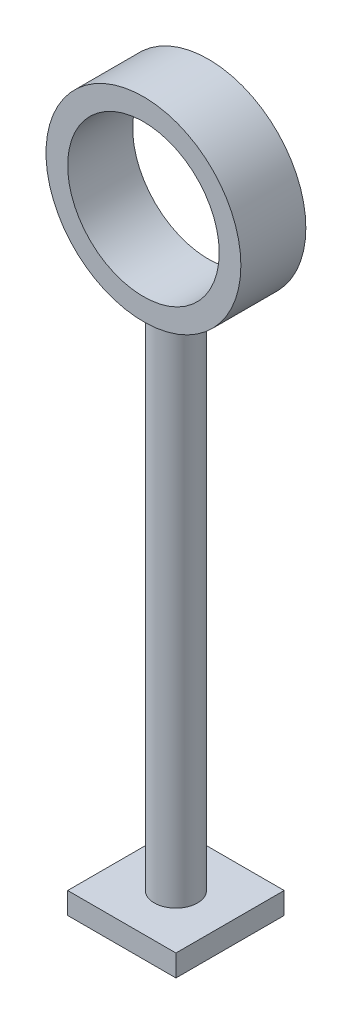
from build123d import *

# Parameters (mm, degrees)
SKETCH_1_R           = 22.5
SKETCH_1_R_2         = 17.5
EXTRUDE_1_DEPTH      = 15
EXTRUDE_2_REACH      = 166.735
EXTRUDE_2_END_RADIUS = 22.5
SKETCH_2_R           = 5
SKETCH_3_W           = 25
SKETCH_3_H           = 25
EXTRUDE_3_DEPTH      = 5


with BuildPart() as part:
    # 草图1 → 凸台-拉伸1 (new body)
    with BuildSketch(Plane.XY):
        Circle(SKETCH_1_R)
        Circle(SKETCH_1_R_2, mode=Mode.SUBTRACT)
    extrude(amount=EXTRUDE_1_DEPTH)

    # 凸台-拉伸2: up to this cylinder (the profile starts outside it)
    extrude_2_end = Plane(origin=(0, 0, 7.5), z_dir=(0, 0, -1)) * Cylinder(EXTRUDE_2_END_RADIUS, 379.47, mode=Mode.PRIVATE)
    # 草图2 → 凸台-拉伸2 (add, up to the surface)
    with BuildSketch(Plane(origin=(0, -140, 0), x_dir=(1, 0, 0), z_dir=(0, 1, 0)), mode=Mode.PRIVATE) as extrude_2_sk1:
        with Locations(Location((0, -7.5, 0), (0, 0, 90))):
            Circle(SKETCH_2_R)
    extrude_2_tool1 = extrude(extrude_2_sk1.sketch, amount=EXTRUDE_2_REACH, mode=Mode.PRIVATE) - extrude_2_end
    add(extrude_2_tool1.solids().sort_by_distance((0, -140, 7.5))[0])

    # 草图3 → 凸台-拉伸3 (add)
    with BuildSketch(Plane.XZ.offset(140)):
        with Locations((0, 7.5)):
            Rectangle(SKETCH_3_W, SKETCH_3_H)
    extrude(amount=EXTRUDE_3_DEPTH)


solid = part.part
